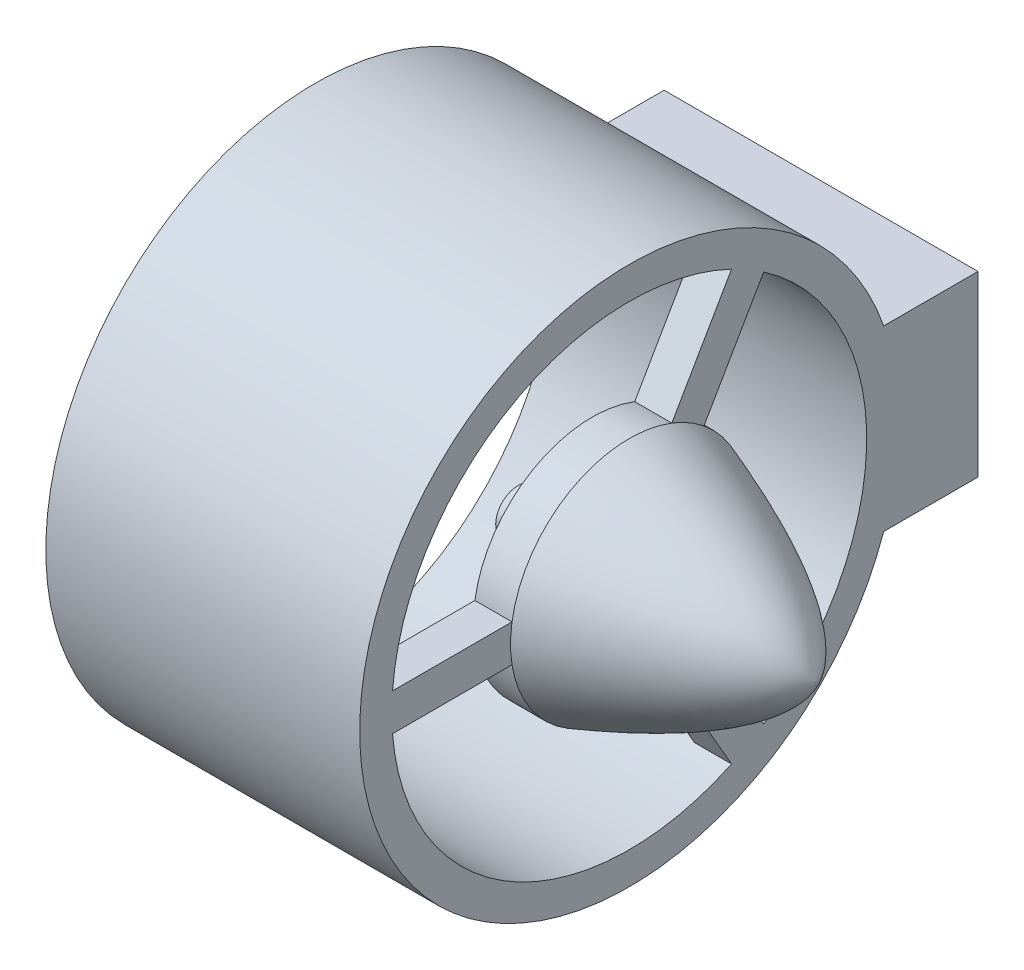
from build123d import *

# Parameters (mm, degrees)
SKETCH_1_R             = 32
EXTRUDE_1_DEPTH        = 5
SKETCH_5_R             = 16
EXTRUDE_2_DEPTH        = 5
SKETCH_7_R             = 32
EXTRUDE_4_DEPTH        = 37.3
CUT_EXTRUDE_1_DEPTH    = 5
SKETCH_11_R            = 3
EXTRUDE_5_DEPTH        = 10
SKETCH_12_R            = 1
CUT_EXTRUDE_3_DEPTH    = 10
HOLE_WIZARD_M3_1_D     = 2.5
HOLE_WIZARD_M3_1_DEPTH = 14.9
HOLE_WIZARD_M3_1_TIP   = 0.751075774


with BuildPart() as part:
    # 草图3 → 旋转1 (revolve)
    with BuildSketch(Plane.XY):
        with BuildLine():
            Line((0, 0), (0, -16))
            add(Edge.make_bspline(
                [(0, -16), (22.5, -8), (25, 0)],
                knots=[0, 0, 0, 1, 1, 1], degree=2))
            Line((25, 0), (0, 0))
        make_face()
    revolve(axis=Axis((25, 0, 0), (-1, 0, 0)))



with BuildPart() as body_2:
    # 草图1 → 凸台-拉伸1 (new body)
    # profile 1 of 4: a face of its own
    with BuildSketch(Plane(origin=(0, 0, 0), x_dir=(0, 0, -1), z_dir=(1, 0, 0))):
        with BuildLine():
            Line((47, 12), (34.290944869, 12))
            ThreePointArc((34.290944869, 12), (-36.33, 0), (34.290944869, -12))
            Line((34.290944869, -12), (47, -12))
            Line((47, -12), (47, 12))
        make_face()
        Circle(SKETCH_1_R, mode=Mode.SUBTRACT)
    # profile 2 of 4: a face of its own
    with BuildSketch(Plane(origin=(0, 0, 0), x_dir=(0, 0, -1), z_dir=(1, 0, 0))):
        with BuildLine():
            ThreePointArc((-15.803480629, -2.5), (-16, 0), (-15.803480629, 2.5))
            Line((-15.803480629, 2.5), (-31.902194282, 2.5))
            ThreePointArc((-31.902194282, 2.5), (-32, 0), (-31.902194282, -2.5))
            Line((-31.902194282, -2.5), (-15.803480629, -2.5))
        make_face()
    # profile 3 of 4: a face of its own
    with BuildSketch(Plane(origin=(0, 0, 0), x_dir=(0, 0, -1), z_dir=(1, 0, 0))):
        with BuildLine():
            Line((13.786033631, 28.878110685), (5.736676805, 14.936215693))
            ThreePointArc((5.736676805, 14.936215693), (8, 13.856406461), (10.066803824, 12.436215693))
            Line((10.066803824, 12.436215693), (18.11616065, 26.378110685))
            ThreePointArc((18.11616065, 26.378110685), (16, 27.712812921), (13.786033631, 28.878110685))
        make_face()
    # profile 4 of 4: a face of its own
    with BuildSketch(Plane(origin=(0, 0, 0), x_dir=(0, 0, -1), z_dir=(1, 0, 0))):
        with BuildLine():
            Line((18.11616065, -26.378110685), (10.066803824, -12.436215693))
            ThreePointArc((10.066803824, -12.436215693), (8, -13.856406461), (5.736676805, -14.936215693))
            Line((5.736676805, -14.936215693), (13.786033631, -28.878110685))
            ThreePointArc((13.786033631, -28.878110685), (16, -27.712812921), (18.11616065, -26.378110685))
        make_face()
    extrude(amount=-EXTRUDE_1_DEPTH)


with BuildPart() as part_1:
    add(part.part)

    add(body_2.part)  # 凸台-拉伸2 merges body 2
    # 草图5 → 凸台-拉伸2 (add)
    with BuildSketch(Plane.ZY):
        Circle(SKETCH_5_R)
    extrude(amount=EXTRUDE_2_DEPTH)

    # 草图7 → 凸台-拉伸4 (add)
    with BuildSketch(Plane.ZY.offset(5)):
        with BuildLine():
            Line((-34.290944869, 12), (-47, 12))
            Line((-47, 12), (-47, -12))
            Line((-47, -12), (-34.290944869, -12))
            ThreePointArc((-34.290944869, -12), (36.33, 0), (-34.290944869, 12))
        make_face()
        with Locations(Location((0, 0, 0), (0, 0, 124.480798786))):
            Circle(SKETCH_7_R, mode=Mode.SUBTRACT)
    extrude(amount=EXTRUDE_4_DEPTH)

    # 草图9 → 切除-拉伸1 (cut)
    with BuildSketch(Plane(origin=(0, 0, -47), x_dir=(-1, 0, 0), z_dir=(0, 0, -1))):
        with BuildLine():
            Line((42.3, -4), (42.3, 4))
            ThreePointArc((42.3, 4), (39.699643621, 2.707512696), (38.65, 0))
            ThreePointArc((38.65, 0), (39.699643621, -2.707512696), (42.3, -4))
        make_face()
    extrude(amount=-CUT_EXTRUDE_1_DEPTH, mode=Mode.SUBTRACT)

    # 草图11 → 凸台-拉伸5 (add)
    with BuildSketch(Plane.ZY.offset(5)):
        Circle(SKETCH_11_R)
    extrude(amount=EXTRUDE_5_DEPTH)

    # 草图12 → 切除-拉伸3 (cut)
    with BuildSketch(Plane.ZY.offset(42.3)):
        with Locations((34, 0)):
            Circle(SKETCH_12_R)
        with Locations((-17, 29.444863729)):
            Circle(SKETCH_12_R)
        with Locations((-17, -29.444863729)):
            Circle(SKETCH_12_R)
    extrude(amount=-CUT_EXTRUDE_3_DEPTH, mode=Mode.SUBTRACT)

    # M3 螺纹孔1
    with Locations(Plane(origin=(0, 0, -47), x_dir=(-1, 0, 0), z_dir=(0, 0, -1))):
        with Locations((3.65, -8), (3.65, 8), (38.65, 8), (38.65, -8)):
            Hole(HOLE_WIZARD_M3_1_D / 2, depth=HOLE_WIZARD_M3_1_DEPTH)
            with Locations((0, 0, -(HOLE_WIZARD_M3_1_DEPTH + HOLE_WIZARD_M3_1_TIP / 2))):  # 118° drill point
                Cone(0, HOLE_WIZARD_M3_1_D / 2, HOLE_WIZARD_M3_1_TIP, mode=Mode.SUBTRACT)


solid = part_1.part
